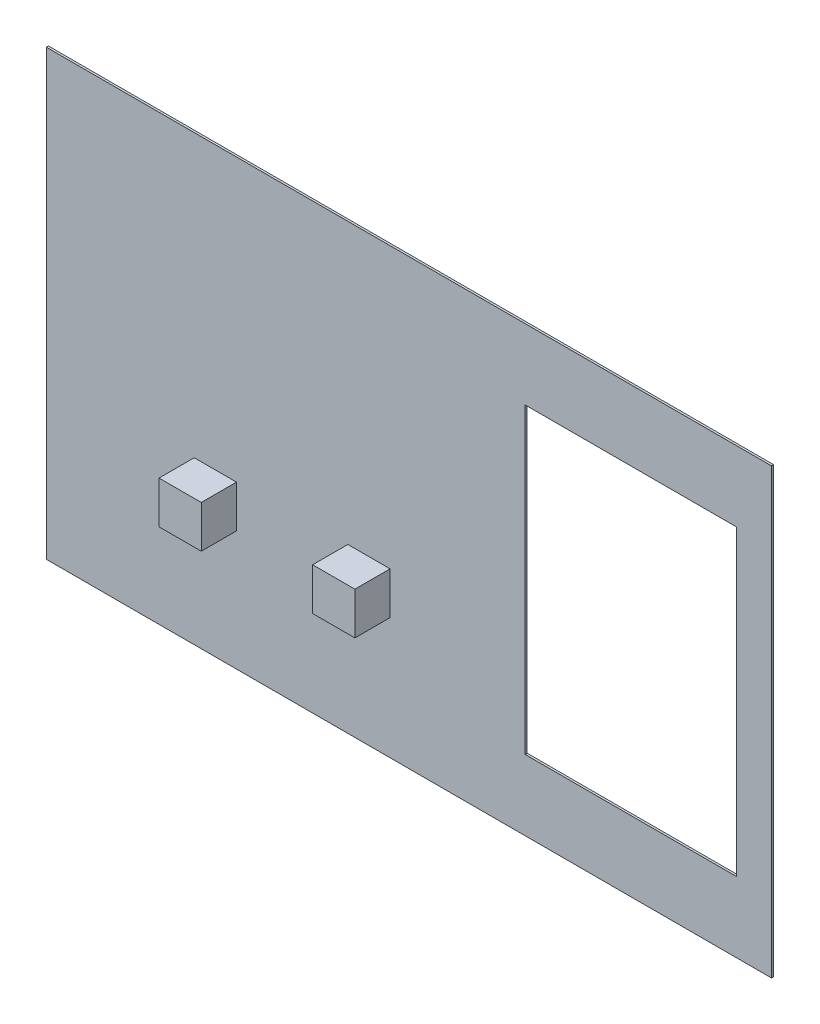
from build123d import *

# Parameters (mm, degrees)
ESQUISSE1_W                  = 1030
ESQUISSE1_H                  = 630
BOSS_EXTRU_1_DEPTH           = 3
ESQUISSE2_W                  = 300
ESQUISSE2_H                  = 430
ENL_V_MAT_EXTRU_1_DEPTH      = 10
ENL_V_MAT_EXTRU_2_DEPTH      = 604.704397864
ENL_V_MAT_EXTRU_2_DEPTH_BACK = 604.704397864
ESQUISSE3_W                  = 60
ESQUISSE3_H                  = 60
ESQUISSE4_W                  = 60
ESQUISSE4_H                  = 60
BOSS_EXTRU_2_DEPTH           = 50
BOSS_EXTRU_2_2_DEPTH         = 50


with BuildPart() as part:
    # Esquisse1 → Boss.-Extru.1 (new body)
    with BuildSketch(Plane.XY):
        Rectangle(ESQUISSE1_W, ESQUISSE1_H)
    extrude(amount=BOSS_EXTRU_1_DEPTH)

    # Esquisse2 → Enlèv. mat.-Extru.1 (cut)
    with BuildSketch(Plane(origin=(0, 0, 0), x_dir=(-1, 0, 0), z_dir=(0, 0, -1))):
        with Locations((-315, 0)):
            Rectangle(ESQUISSE2_W, ESQUISSE2_H)
    extrude(amount=-ENL_V_MAT_EXTRU_1_DEPTH, mode=Mode.SUBTRACT)

    # Esquisse3 → Enlèv. mat.-Extru.2 (cut, two sides: drawn at the far end of the back side and taken through both)
    with BuildSketch(Plane.XY.offset(3).offset(-ENL_V_MAT_EXTRU_2_DEPTH_BACK)):
        with Locations((-275, -115)):
            Rectangle(ESQUISSE3_W, ESQUISSE3_H)
        with Locations((-56.776559507, -112.543167667)):
            Rectangle(ESQUISSE3_W, ESQUISSE3_H)
    extrude(amount=ENL_V_MAT_EXTRU_2_DEPTH + ENL_V_MAT_EXTRU_2_DEPTH_BACK, mode=Mode.SUBTRACT)


with BuildPart() as body_2:
    # Esquisse4 → Boss.-Extru.2 (new body)
    with BuildSketch(Plane.XY.offset(3)):
        with Locations((-275, -115)):
            Rectangle(ESQUISSE4_W, ESQUISSE4_H)
    extrude(amount=BOSS_EXTRU_2_DEPTH)


with BuildPart() as body_3:
    # Esquisse4 → Boss.-Extru.2 2 (new body)
    with BuildSketch(Plane.XY.offset(3)):
        with Locations((-56.776559507, -112.543167667)):
            Rectangle(ESQUISSE4_W, ESQUISSE4_H)
    extrude(amount=BOSS_EXTRU_2_2_DEPTH)


solid = Compound([part.part, body_2.part, body_3.part])
